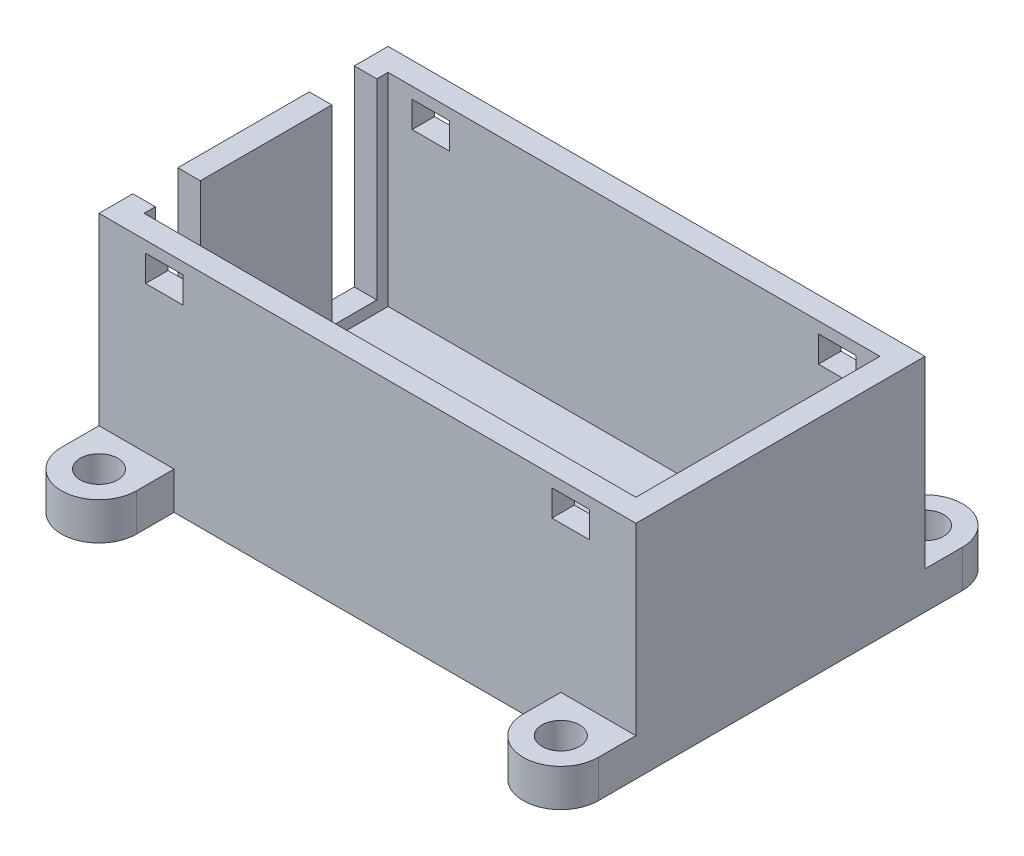
from build123d import *

# Parameters (mm, degrees)
SKETCH1_W           = 71.5
SKETCH1_H           = 38.5
BOSS_EXTRUDE1_DEPTH = 29.5
SKETCH1_4_W         = 65.5
SKETCH1_4_H         = 32.5
CUT_EXTRUDE1_DEPTH  = 27
SKETCH3_W           = 6
SKETCH3_H           = 25.5
CUT_EXTRUDE2_DEPTH  = 29
BOSS_EXTRUDE3_DEPTH = 5
BOSS_EXTRUDE4_DEPTH = 5
BOSS_EXTRUDE5_DEPTH = 5
BOSS_EXTRUDE6_DEPTH = 5
SKETCH5_9_R         = 2.5
CUT_EXTRUDE3_DEPTH  = 15
SKETCH5_10_R        = 2.5
CUT_EXTRUDE4_DEPTH  = 20
SKETCH5_11_R        = 2.5
CUT_EXTRUDE5_DEPTH  = 20
SKETCH5_12_R        = 2.5
CUT_EXTRUDE6_DEPTH  = 20
SKETCH4_W           = 5
SKETCH4_H           = 3.5
CUT_EXTRUDE7_DEPTH  = 63
SKETCH4_3_W         = 5
SKETCH4_3_H         = 3.5
CUT_EXTRUDE8_DEPTH  = 63


with BuildPart() as part:
    # Sketch1 → Boss-Extrude1 (new body)
    with BuildSketch(Plane(origin=(0, 0, 0), x_dir=(1, 0, 0), z_dir=(0, 1, 0))):
        with Locations((35.75, 19.25)):
            Rectangle(SKETCH1_W, SKETCH1_H)
    extrude(amount=-BOSS_EXTRUDE1_DEPTH)

    # Sketch1<4> → Cut-Extrude1 (cut)
    with BuildSketch(Plane(origin=(0, 0, 0), x_dir=(1, 0, 0), z_dir=(0, 1, 0))):
        with Locations((35.75, 19.25)):
            Rectangle(SKETCH1_4_W, SKETCH1_4_H)
    extrude(amount=-CUT_EXTRUDE1_DEPTH, mode=Mode.SUBTRACT)

    # Sketch3 → Cut-Extrude2 (cut)
    with BuildSketch(Plane.ZY):
        with Locations((-7.5, -12.75)):
            Rectangle(SKETCH3_W, SKETCH3_H)
        with Locations((-31, -12.75)):
            Rectangle(SKETCH3_W, SKETCH3_H)
    extrude(amount=-CUT_EXTRUDE2_DEPTH, mode=Mode.SUBTRACT)

    # Sketch5 → Boss-Extrude3 (add)
    with BuildSketch(Plane.XZ.offset(29.5)):
        with BuildLine():
            Line((61.5, 0), (61.5, 5))
            ThreePointArc((61.5, 5), (66.5, 10), (71.5, 5))
            Line((71.5, 5), (71.5, 0))
            Line((71.5, 0), (61.5, 0))
        make_face()
    extrude(amount=-BOSS_EXTRUDE3_DEPTH)

    # Sketch5<5> → Boss-Extrude4 (add)
    with BuildSketch(Plane.XZ.offset(29.5)):
        with BuildLine():
            Line((0, 0), (10, 0))
            Line((10, 0), (10, 5))
            ThreePointArc((10, 5), (5, 10), (0, 5))
            Line((0, 5), (0, 0))
        make_face()
    extrude(amount=-BOSS_EXTRUDE4_DEPTH)

    # Sketch5<7> → Boss-Extrude5 (add)
    with BuildSketch(Plane.XZ.offset(29.5)):
        with BuildLine():
            Line((71.5, -38.5), (71.5, -43.5))
            ThreePointArc((71.5, -43.5), (66.5, -48.5), (61.5, -43.5))
            Line((61.5, -43.5), (61.5, -38.5))
            Line((61.5, -38.5), (71.5, -38.5))
        make_face()
    extrude(amount=-BOSS_EXTRUDE5_DEPTH)

    # Sketch5<8> → Boss-Extrude6 (add)
    with BuildSketch(Plane.XZ.offset(29.5)):
        with BuildLine():
            Line((10, -38.5), (10, -43.5))
            ThreePointArc((10, -43.5), (5, -48.5), (0, -43.5))
            Line((0, -43.5), (0, -38.5))
            Line((0, -38.5), (10, -38.5))
        make_face()
    extrude(amount=-BOSS_EXTRUDE6_DEPTH)

    # Sketch5<9> → Cut-Extrude3 (cut)
    with BuildSketch(Plane.XZ.offset(29.5)):
        with Locations((66.5, 5)):
            Circle(SKETCH5_9_R)
    extrude(amount=-CUT_EXTRUDE3_DEPTH, mode=Mode.SUBTRACT)

    # Sketch5<10> → Cut-Extrude4 (cut)
    with BuildSketch(Plane.XZ.offset(29.5)):
        with Locations((5, 5)):
            Circle(SKETCH5_10_R)
    extrude(amount=-CUT_EXTRUDE4_DEPTH, mode=Mode.SUBTRACT)

    # Sketch5<11> → Cut-Extrude5 (cut)
    with BuildSketch(Plane.XZ.offset(29.5)):
        with Locations((5, -43.5)):
            Circle(SKETCH5_11_R)
    extrude(amount=-CUT_EXTRUDE5_DEPTH, mode=Mode.SUBTRACT)

    # Sketch5<12> → Cut-Extrude6 (cut)
    with BuildSketch(Plane.XZ.offset(29.5)):
        with Locations((66.5, -43.5)):
            Circle(SKETCH5_12_R)
    extrude(amount=-CUT_EXTRUDE6_DEPTH, mode=Mode.SUBTRACT)

    # Sketch4 → Cut-Extrude7 (cut)
    with BuildSketch(Plane(origin=(0, 0, -38.5), x_dir=(-1, 0, 0), z_dir=(0, 0, -1))):
        with Locations((-62.806579946, -3.25)):
            Rectangle(SKETCH4_W, SKETCH4_H)
    extrude(amount=-CUT_EXTRUDE7_DEPTH, mode=Mode.SUBTRACT)

    # Sketch4<3> → Cut-Extrude8 (cut)
    with BuildSketch(Plane(origin=(0, 0, -38.5), x_dir=(-1, 0, 0), z_dir=(0, 0, -1))):
        with Locations((-8.693420054, -3.25)):
            Rectangle(SKETCH4_3_W, SKETCH4_3_H)
    extrude(amount=-CUT_EXTRUDE8_DEPTH, mode=Mode.SUBTRACT)


solid = part.part
